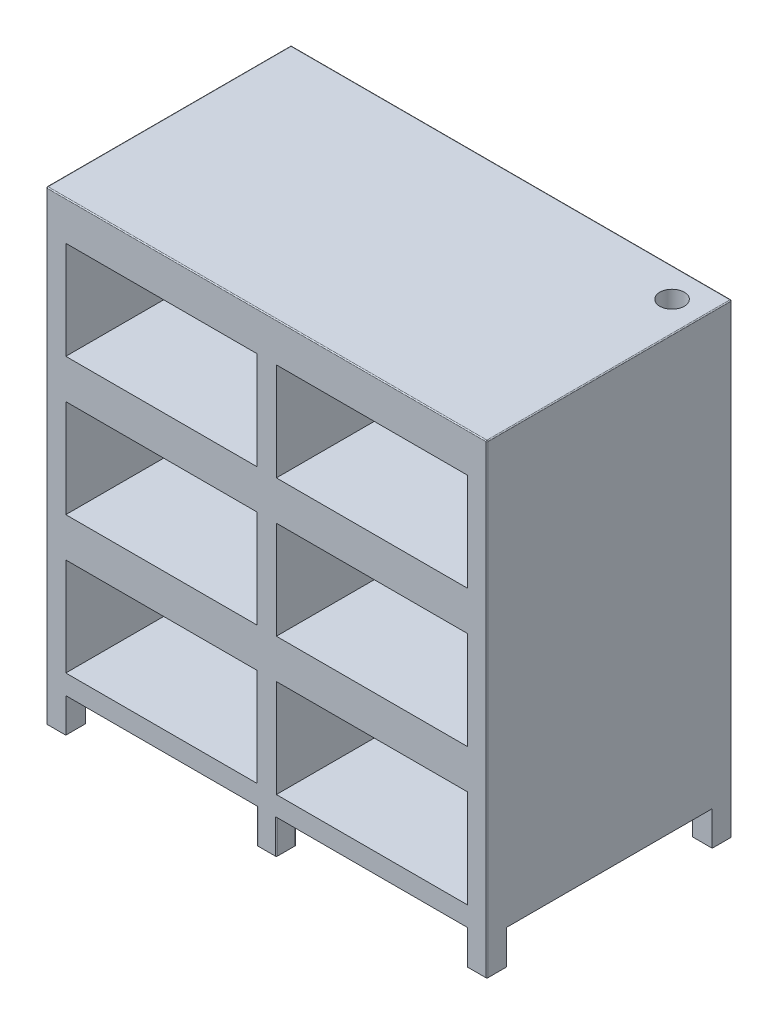
from build123d import *

# Parameters (mm, degrees)
SKETCH3_W            = 50.8
SKETCH3_H            = 50.8
BOSS_EXTRUDE1_DEPTH  = 88.9
SKETCH4_W            = 50.8
SKETCH4_H            = 50.8
BOSS_EXTRUDE2_DEPTH  = 88.9
SKETCH5_W            = 50.8
SKETCH5_H            = 50.8
BOSS_EXTRUDE3_DEPTH  = 88.9
FILLET1_R            = 0.1
FILLET2_R            = 0.1
FILLET3_R            = 0.1
SKETCH6_W            = 50.8
SKETCH6_H            = 50.8
BOSS_EXTRUDE4_DEPTH  = 88.9
FILLET4_R            = 0.1
SKETCH8_W            = 50.8
SKETCH8_H            = 50.8
BOSS_EXTRUDE5_DEPTH  = 88.9
SKETCH9_W            = 50.8
SKETCH9_H            = 50.8
BOSS_EXTRUDE6_DEPTH  = 88.9
FILLET5_R            = 2.54
FILLET6_R            = 2.54
SKETCH10_W           = 1143
SKETCH10_H           = 635
BOSS_EXTRUDE7_DEPTH  = 1117.6
SKETCH11_W           = 495.3
SKETCH11_H           = 253.909609279
CUT_EXTRUDE1_DEPTH   = 558.8
FILLET7_R            = 2.54
LPATTERN1_COUNT      = 3
LPATTERN1_PITCH      = 355.6
LPATTERN1_COUNT_DIR2 = 2
LPATTERN1_PITCH_DIR2 = 546.1
SKETCH13_R           = 31.75
CUT_EXTRUDE2_DEPTH   = 970.026


with BuildPart() as part:
    # Sketch3 → Boss-Extrude1 (new body)
    with BuildSketch(Plane(origin=(0, 0, 0), x_dir=(1, 0, 0), z_dir=(0, 1, 0))):
        with Locations((546.1, 292.1)):
            Rectangle(SKETCH3_W, SKETCH3_H)
    extrude(amount=BOSS_EXTRUDE1_DEPTH)

    # Fillet2
    fillet2_edges = [part.edges().sort_by_distance(p)[0] for p in [
        (520.7, 44.45, -317.5),
        (571.5, 44.45, -317.5),
        (571.5, 44.45, -266.7),
        (520.7, 44.45, -266.7),
    ]]
    fillet(fillet2_edges, radius=FILLET2_R)



with BuildPart() as body_2:
    # Sketch4 → Boss-Extrude2 (new body)
    with BuildSketch(Plane(origin=(0, 0, 0), x_dir=(1, 0, 0), z_dir=(0, 1, 0))):
        with Locations((546.1, -292.1)):
            Rectangle(SKETCH4_W, SKETCH4_H)
    extrude(amount=BOSS_EXTRUDE2_DEPTH)

    # Fillet1
    fillet1_edges = [body_2.edges().sort_by_distance(p)[0] for p in [
        (520.7, 44.45, 266.7),
        (571.5, 44.45, 266.7),
        (571.5, 44.45, 317.5),
        (520.7, 44.45, 317.5),
    ]]
    fillet(fillet1_edges, radius=FILLET1_R)


with BuildPart() as body_3:
    # Sketch5 → Boss-Extrude3 (new body)
    with BuildSketch(Plane(origin=(0, 0, 0), x_dir=(1, 0, 0), z_dir=(0, 1, 0))):
        with Locations((-546.1, 292.1)):
            Rectangle(SKETCH5_W, SKETCH5_H)
    extrude(amount=BOSS_EXTRUDE3_DEPTH)

    # Fillet3
    fillet3_edges = [body_3.edges().sort_by_distance(p)[0] for p in [
        (-520.7, 44.45, -266.7),
        (-571.5, 44.45, -266.7),
        (-571.5, 44.45, -317.5),
        (-520.7, 44.45, -317.5),
    ]]
    fillet(fillet3_edges, radius=FILLET3_R)


with BuildPart() as body_4:
    # Sketch6 → Boss-Extrude4 (new body)
    with BuildSketch(Plane(origin=(0, 0, 0), x_dir=(1, 0, 0), z_dir=(0, 1, 0))):
        with Locations((-546.1, -292.1)):
            Rectangle(SKETCH6_W, SKETCH6_H)
    extrude(amount=BOSS_EXTRUDE4_DEPTH)

    # Fillet4
    fillet4_edges = [body_4.edges().sort_by_distance(p)[0] for p in [
        (-520.7, 44.45, 317.5),
        (-571.5, 44.45, 317.5),
        (-571.5, 44.45, 266.7),
        (-520.7, 44.45, 266.7),
    ]]
    fillet(fillet4_edges, radius=FILLET4_R)


with BuildPart() as body_5:
    # Sketch8 → Boss-Extrude5 (new body)
    with BuildSketch(Plane(origin=(0, 0, 0), x_dir=(1, 0, 0), z_dir=(0, 1, 0))):
        with Locations((0, 292.1)):
            Rectangle(SKETCH8_W, SKETCH8_H)
    extrude(amount=BOSS_EXTRUDE5_DEPTH)

    # Fillet6
    fillet6_edges = [body_5.edges().sort_by_distance(p)[0] for p in [
        (25.4, 44.45, -266.7),
        (-25.4, 44.45, -266.7),
        (-25.4, 44.45, -317.5),
        (25.4, 44.45, -317.5),
    ]]
    fillet(fillet6_edges, radius=FILLET6_R)


with BuildPart() as body_6:
    # Sketch9 → Boss-Extrude6 (new body)
    with BuildSketch(Plane(origin=(0, 0, 0), x_dir=(1, 0, 0), z_dir=(0, 1, 0))):
        with Locations((0, -292.1)):
            Rectangle(SKETCH9_W, SKETCH9_H)
    extrude(amount=BOSS_EXTRUDE6_DEPTH)

    # Fillet5
    fillet5_edges = [body_6.edges().sort_by_distance(p)[0] for p in [
        (25.4, 44.45, 317.5),
        (-25.4, 44.45, 317.5),
        (-25.4, 44.45, 266.7),
        (25.4, 44.45, 266.7),
    ]]
    fillet(fillet5_edges, radius=FILLET5_R)


with BuildPart() as part_1:
    add(part.part)

    add(body_2.part)  # Boss-Extrude7 merges body 2

    add(body_3.part)  # Boss-Extrude7 merges body 3

    add(body_4.part)  # Boss-Extrude7 merges body 4

    add(body_5.part)  # Boss-Extrude7 merges body 5

    add(body_6.part)  # Boss-Extrude7 merges body 6
    # Sketch10 → Boss-Extrude7 (add)
    with BuildSketch(Plane(origin=(0, 88.9, 0), x_dir=(1, 0, 0), z_dir=(0, 1, 0))):
        Rectangle(SKETCH10_W, SKETCH10_H)
    extrude(amount=BOSS_EXTRUDE7_DEPTH)

    # Sketch11 → Cut-Extrude1 (cut)
    with BuildSketch(Plane.XY.offset(317.5)):
        with Locations((-273.05, 266.65480464)):
            Rectangle(SKETCH11_W, SKETCH11_H)
    cut_extrude1 = extrude(amount=-CUT_EXTRUDE1_DEPTH, mode=Mode.SUBTRACT)

    # Fillet7
    fillet7_edges = [part_1.edges().sort_by_distance(p)[0] for p in [
        (-571.5, 1206.5, 0),
        (0, 1206.5, 317.5),
        (0, 1206.5, -317.5),
        (571.5, 1206.5, 0),
        (571.5, 647.7, -317.5),
        (571.5, 647.7, 317.5),
        (-571.5, 647.7, 317.5),
    ]]
    fillet(fillet7_edges, radius=FILLET7_R)

    # LPattern1: Cut-Extrude1 3 × 2
    with Locations(*[(j * LPATTERN1_PITCH_DIR2, i * LPATTERN1_PITCH, 0) for i in range(LPATTERN1_COUNT) for j in range(LPATTERN1_COUNT_DIR2) if (i, j) != (0, 0)]):
        add(cut_extrude1, mode=Mode.SUBTRACT)

    # Sketch13 → Cut-Extrude2 (cut)
    with BuildSketch(Plane(origin=(0, 1206.5, 0), x_dir=(1, 0, 0), z_dir=(0, 1, 0))):
        with Locations(Location((492.76, 241.3, 0), (0, 0, 270))):
            Circle(SKETCH13_R)
    extrude(amount=-CUT_EXTRUDE2_DEPTH, mode=Mode.SUBTRACT)


solid = part_1.part
